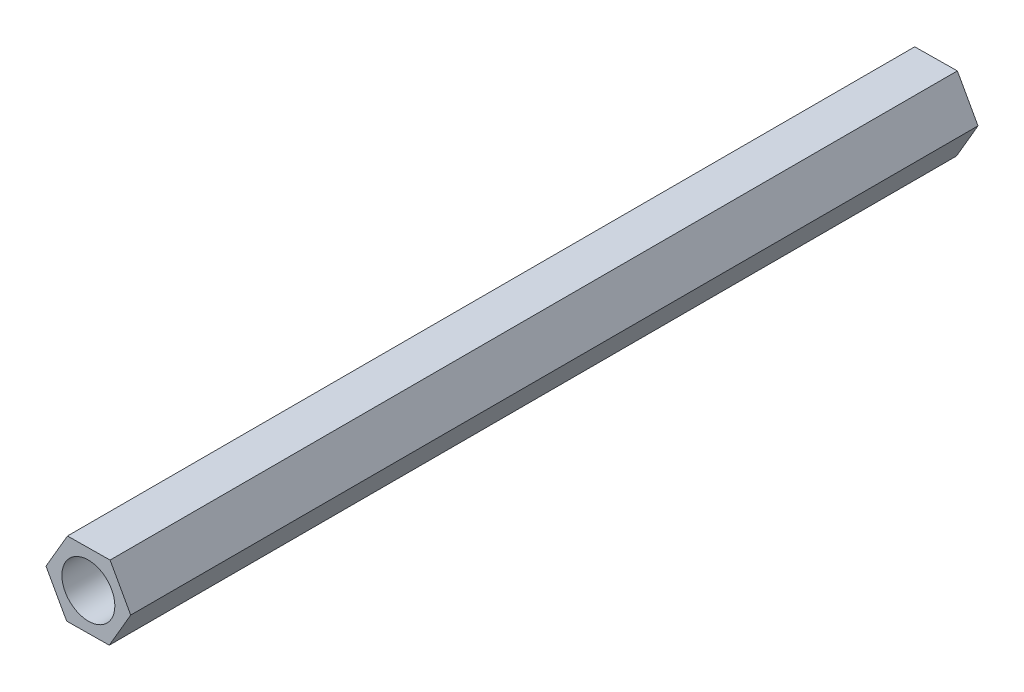
from build123d import *

# Parameters (mm, degrees)
SKETCH_1_R      = 2.5
EXTRUDE_1_DEPTH = 80


with BuildPart() as part:
    # 草图1 → 凸台-拉伸1 (new body)
    with BuildSketch(Plane.XY):
        Polygon((-1.974290183, 3.478818517), (2.05110136, 3.522424255), (4, 0), (1.974290183, -3.478818517), (-2.05110136, -3.522424255), (-4, 0), align=None)
        Circle(SKETCH_1_R, mode=Mode.SUBTRACT)
    extrude(amount=EXTRUDE_1_DEPTH)


solid = part.part
